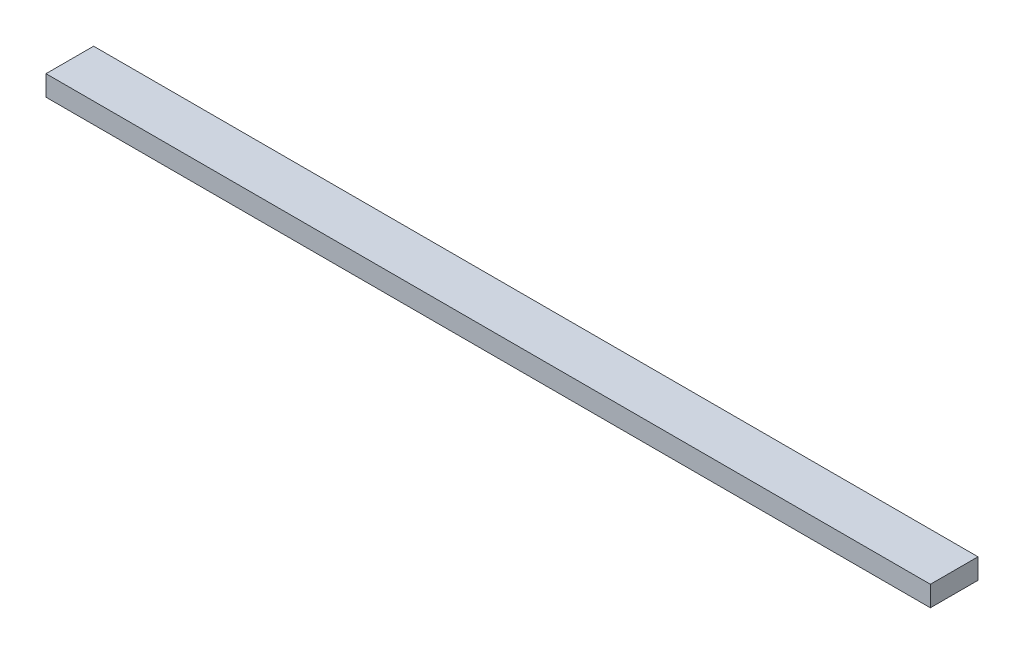
from build123d import *

# Parameters (mm, degrees)
SKETCH1_W           = 88.9
SKETCH1_H           = 38.1
BOSS_EXTRUDE1_DEPTH = 1651


with BuildPart() as part:
    # Sketch1 → Boss-Extrude1 (new body)
    with BuildSketch(Plane(origin=(0, 0, 0), x_dir=(0, 0, -1), z_dir=(1, 0, 0))):
        Rectangle(SKETCH1_W, SKETCH1_H)
    extrude(amount=BOSS_EXTRUDE1_DEPTH)


solid = part.part
